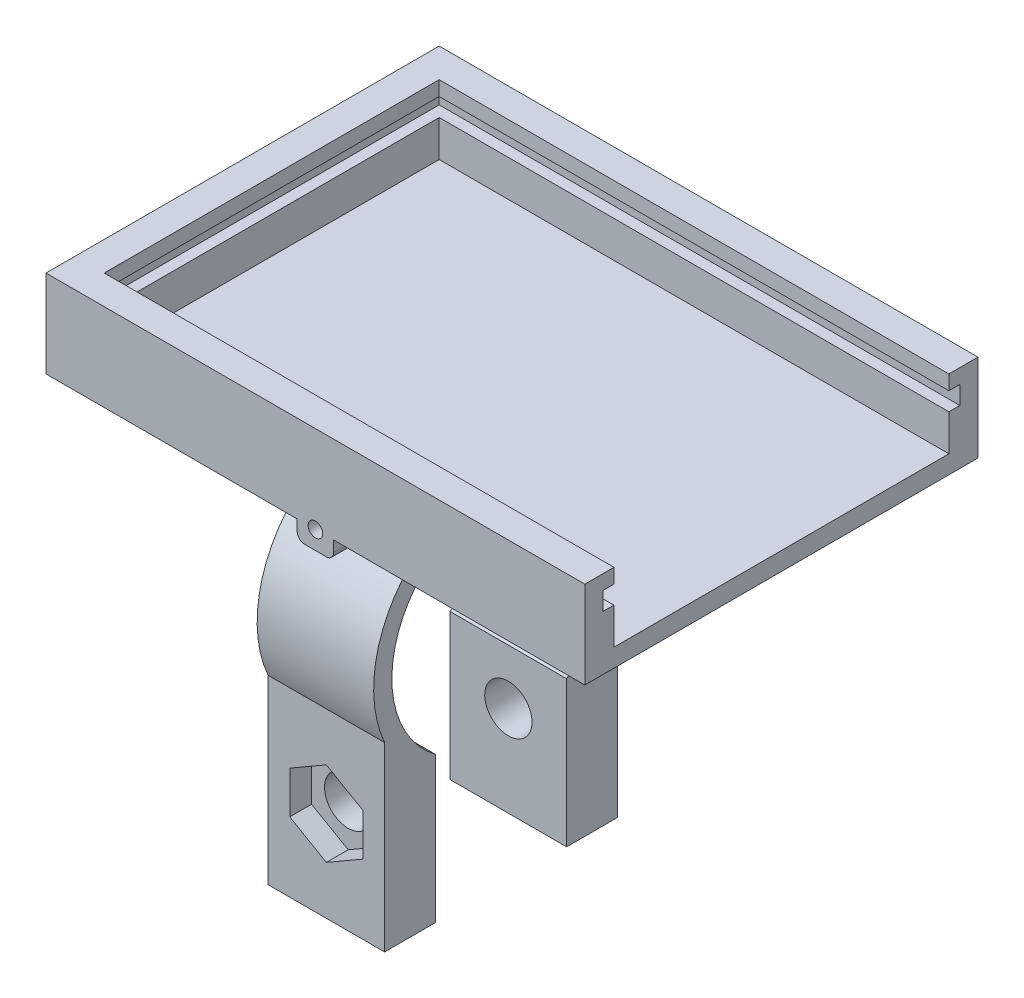
from build123d import *

# Parameters (mm, degrees)
CROQUIS1_W              = 74
CROQUIS1_H              = 54
SALIENTE_EXTRUIR1_DEPTH = 2.5
SALIENTE_EXTRUIR2_DEPTH = 2.5
SALIENTE_EXTRUIR3_DEPTH = 2
CROQUIS4_W              = 74
CROQUIS4_H              = 54
SALIENTE_EXTRUIR4_DEPTH = 5
CROQUIS5_W              = 70
CROQUIS5_H              = 46
CORTAR_EXTRUIR1_DEPTH   = 5
CROQUIS6_W              = 5
CROQUIS6_H              = 54
SALIENTE_EXTRUIR5_DEPTH = 2.5
REDONDEO1_R             = 1
CROQUIS7_R              = 1
CORTAR_EXTRUIR2_DEPTH   = 100
SALIENTE_EXTRUIR9_DEPTH = 8
CROQUIS10_R             = 15
CORTAR_EXTRUIR3_DEPTH   = 16
CORTAR_EXTRUIR4_DEPTH   = 3
CROQUIS12_R             = 3.25
CORTAR_EXTRUIR5_DEPTH   = 100


with BuildPart() as part:
    # Croquis1 → Saliente-Extruir1 (new body)
    with BuildSketch(Plane(origin=(0, 0, 0), x_dir=(1, 0, 0), z_dir=(0, 1, 0))):
        Rectangle(CROQUIS1_W, CROQUIS1_H)
    extrude(amount=SALIENTE_EXTRUIR1_DEPTH)

    # Croquis2 → Saliente-Extruir2 (add)
    with BuildSketch(Plane(origin=(0, 2.5, 0), x_dir=(1, 0, 0), z_dir=(0, 1, 0))):
        Polygon((-34.5, 24.5), (34.5, 24.5), (37, 24.5), (37, 27), (-37, 27), (-37, -27), (37, -27), (37, -24.5), (34.5, -24.5), (-34.5, -24.5), align=None)
    extrude(amount=SALIENTE_EXTRUIR2_DEPTH)

    # Croquis3 → Saliente-Extruir3 (add)
    with BuildSketch(Plane(origin=(0, 5, 0), x_dir=(1, 0, 0), z_dir=(0, 1, 0))):
        Polygon((37, 23), (37, 24.5), (-34.5, 24.5), (-34.5, -24.5), (37, -24.5), (37, -23), (33, -23), (-33, -23), (-33, 23), (33, 23), align=None)
        Polygon((37, -27), (37, -24.5), (-34.5, -24.5), (-34.5, 24.5), (37, 24.5), (37, 27), (-37, 27), (-37, -27), align=None)
    extrude(amount=SALIENTE_EXTRUIR3_DEPTH)

    # Croquis4 → Saliente-Extruir4 (add)
    with BuildSketch(Plane.XZ):
        Rectangle(CROQUIS4_W, CROQUIS4_H)
    extrude(amount=SALIENTE_EXTRUIR4_DEPTH)

    # Croquis5 → Cortar-Extruir1 (cut)
    with BuildSketch(Plane(origin=(0, 2.5, 0), x_dir=(1, 0, 0), z_dir=(0, 1, 0))):
        with Locations((2, 0)):
            Rectangle(CROQUIS5_W, CROQUIS5_H)
    extrude(amount=-CORTAR_EXTRUIR1_DEPTH, mode=Mode.SUBTRACT)

    # Croquis6 → Saliente-Extruir5 (add, symmetric)
    with BuildSketch(Plane.XZ.offset(5)):
        Rectangle(CROQUIS6_W, CROQUIS6_H)
    extrude(amount=SALIENTE_EXTRUIR5_DEPTH, both=True)

    # Redondeo1
    redondeo1_edges = [part.edges().sort_by_distance(p)[0] for p in [
        (-2.5, -7.5, 0),
        (2.5, -7.5, 0),
    ]]
    fillet(redondeo1_edges, radius=REDONDEO1_R)

    # Croquis7 → Cortar-Extruir2 (cut)
    with BuildSketch(Plane.XY.offset(27)):
        with Locations((0, -5)):
            Circle(CROQUIS7_R)
    extrude(amount=-CORTAR_EXTRUIR2_DEPTH, mode=Mode.SUBTRACT)

    # Croquis10 → Cortar-Extruir3 (cut)
    with BuildSketch(Plane(origin=(8, 0, 0), x_dir=(0, 0, -1), z_dir=(1, 0, 0))):
        with Locations((-9.5, -20)):
            Circle(CROQUIS10_R)
    extrude(amount=-CORTAR_EXTRUIR3_DEPTH, mode=Mode.SUBTRACT)


with BuildPart() as body_2:
    # Croquis9 → Saliente-Extruir9 (new, symmetric)
    with BuildSketch(Plane(origin=(0, 0, 0), x_dir=(0, 0, -1), z_dir=(1, 0, 0))):
        with BuildLine():
            Line((-18.5, -32), (-18.5, -52))
            Line((-18.5, -52), (-25.5, -52))
            Line((-25.5, -52), (-25.5, -27.088723439))
            ThreePointArc((-25.5, -27.088723439), (-9.5, -2.5), (6.5, -27.088723439))
            Line((6.5, -27.088723439), (6.5, -52))
            Line((6.5, -52), (-0.5, -52))
            Line((-0.5, -52), (-0.5, -32))
            ThreePointArc((-0.5, -32), (-9.5, -5), (-18.5, -32))
        make_face()
    extrude(amount=SALIENTE_EXTRUIR9_DEPTH, both=True)

    # Croquis11 → Cortar-Extruir4 (cut)
    with BuildSketch(Plane.XY.offset(25.5)):
        Polygon((0, -45.34436172), (5.022947342, -42.44436172), (5.022947342, -36.64436172), (0, -33.74436172), (-5.022947342, -36.64436172), (-5.022947342, -42.44436172), align=None)
    extrude(amount=-CORTAR_EXTRUIR4_DEPTH, mode=Mode.SUBTRACT)

    # Croquis12 → Cortar-Extruir5 (cut)
    with BuildSketch(Plane.XY.offset(22.5)):
        with Locations(Location((0, -39.54436172, 0), (0, 0, 90))):
            Circle(CROQUIS12_R)
    extrude(amount=-CORTAR_EXTRUIR5_DEPTH, mode=Mode.SUBTRACT)


solid = Compound([part.part, body_2.part])
